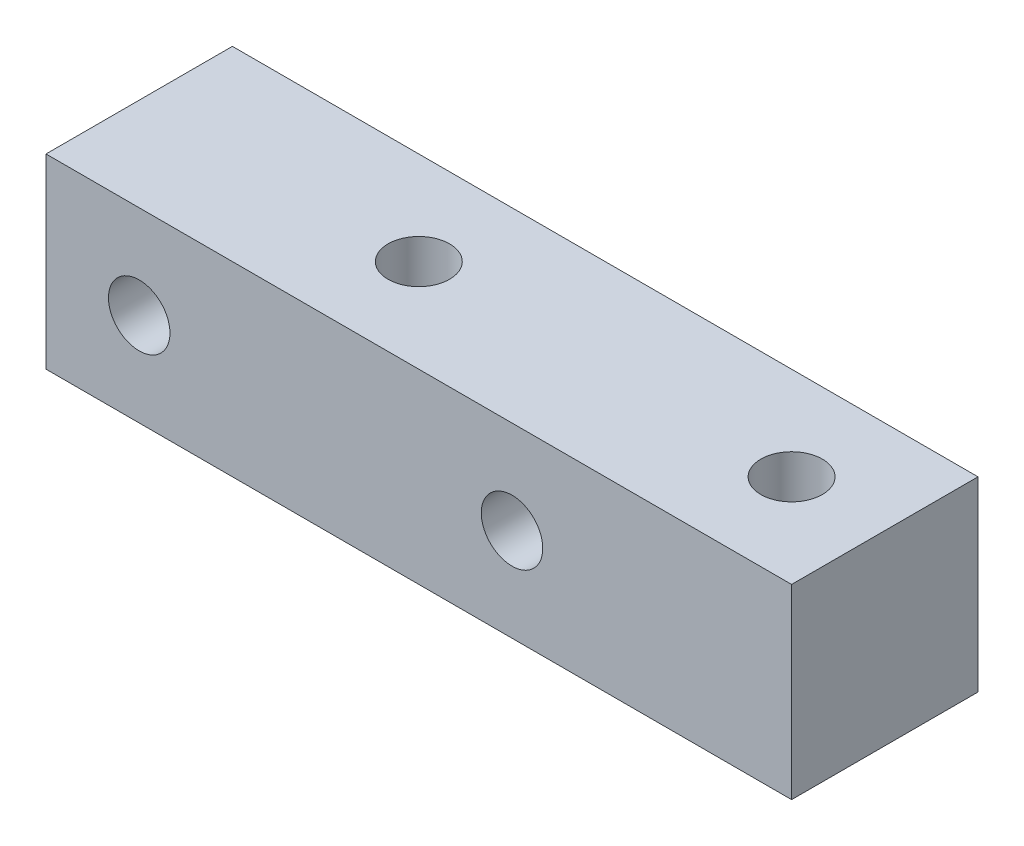
from build123d import *

# Parameters (mm, degrees)
SKETCH_1_W                   = 40
SKETCH_1_H                   = 10
EXTRUDE_1_DEPTH              = 10
HOLE_WIZARD_M4_1_D           = 3.3
HOLE_WIZARD_M4_1_ON_FACE_2_D = 3.3


with BuildPart() as part:
    # 草图1 → 凸台-拉伸1 (new body)
    with BuildSketch(Plane.XY):
        Rectangle(SKETCH_1_W, SKETCH_1_H)
    extrude(amount=EXTRUDE_1_DEPTH)

    # M4 螺纹孔的螺纹孔钻头1 (through all)
    with Locations(Plane(origin=(-5, 5, 5), x_dir=(1, 0, 0), z_dir=(0, 1, 0))):
        with Locations((0, 0), (20, 0)):
            Hole(HOLE_WIZARD_M4_1_D / 2)

    # M4 螺纹孔的螺纹孔钻头1 on face 2 (through all)
    with Locations(Plane(origin=(5, 0, 10), x_dir=(1, 0, 0), z_dir=(0, 0, 1))):
        with Locations((0, 0), (-20, 0)):
            Hole(HOLE_WIZARD_M4_1_ON_FACE_2_D / 2)


solid = part.part
